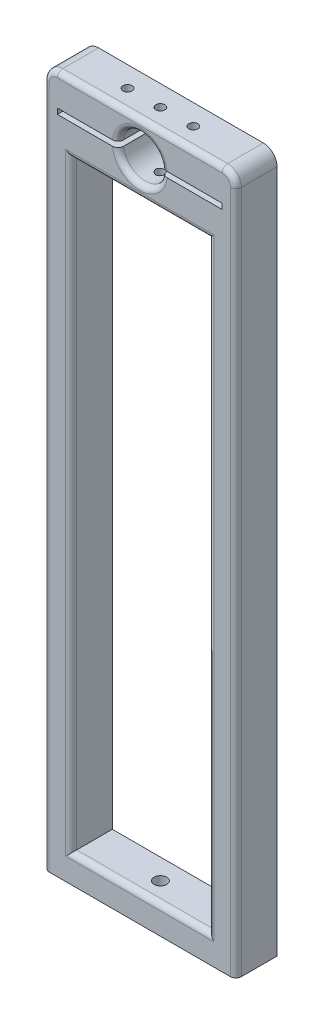
from build123d import *

# Parameters (mm, degrees)
SKETCH_1_W          = 70
SKETCH_1_H          = 15
EXTRUDE_3_DEPTH     = 254
SKETCH_5_W          = 50
SKETCH_5_H          = 219
CUT_EXTRUDE_2_DEPTH = 150
SKETCH_6_R          = 8
CUT_EXTRUDE_3_DEPTH = 150
FILLET_1_R          = 2
FILLET_2_R          = 5
FILLET_3_R          = 5
SKETCH_7_R          = 2.3
CUT_EXTRUDE_4_DEPTH = 150
SKETCH_8_W          = 60
SKETCH_8_H          = 2
CUT_EXTRUDE_5_DEPTH = 257.838470639
FILLET_4_R          = 2
FILLET_7_R          = 2
SKETCH_9_R          = 1.65
CUT_EXTRUDE_6_DEPTH = 30


with BuildPart() as part:
    # 草图1 → 凸台-拉伸3 (new body)
    with BuildSketch(Plane(origin=(0, 0, 0), x_dir=(1, 0, 0), z_dir=(0, 1, 0))):
        Rectangle(SKETCH_1_W, SKETCH_1_H)
    extrude(amount=EXTRUDE_3_DEPTH)

    # 草图5 → 切除-拉伸2 (cut)
    with BuildSketch(Plane.XY.offset(7.5)):
        with Locations((0, 119.5)):
            Rectangle(SKETCH_5_W, SKETCH_5_H)
    extrude(amount=-CUT_EXTRUDE_2_DEPTH, mode=Mode.SUBTRACT)

    # 草图6 → 切除-拉伸3 (cut)
    with BuildSketch(Plane.XY.offset(7.5)):
        with Locations((0, 241.5)):
            Circle(SKETCH_6_R)
    extrude(amount=-CUT_EXTRUDE_3_DEPTH, mode=Mode.SUBTRACT)

    # 圆角1
    fillet_1_edges = [part.edges().sort_by_distance(p)[0] for p in [
        (-8, 241.5, 7.5),
    ]]
    fillet(fillet_1_edges, radius=FILLET_1_R)

    # 圆角2
    fillet_2_edges = [part.edges().sort_by_distance(p)[0] for p in [
        (-35, 254, 0),
    ]]
    fillet(fillet_2_edges, radius=FILLET_2_R)

    # 圆角3
    fillet_3_edges = [part.edges().sort_by_distance(p)[0] for p in [
        (35, 254, 0),
    ]]
    fillet(fillet_3_edges, radius=FILLET_3_R)

    # 草图7 → 切除-拉伸4 (cut)
    with BuildSketch(Plane(origin=(0, 10, 0), x_dir=(1, 0, 0), z_dir=(0, 1, 0))):
        with Locations(Location((0, 0, 0), (0, 0, 270))):
            Circle(SKETCH_7_R)
    extrude(amount=-CUT_EXTRUDE_4_DEPTH, mode=Mode.SUBTRACT)

    # 草图8 → 切除-拉伸5 (cut, through all)
    with BuildSketch(Plane(origin=(0, 0, -7.5), x_dir=(-1, 0, 0), z_dir=(0, 0, -1))):
        with Locations((0, 241.5)):
            Rectangle(SKETCH_8_W, SKETCH_8_H)
    extrude(amount=-CUT_EXTRUDE_5_DEPTH, mode=Mode.SUBTRACT)

    # 圆角4
    fillet_4_edges = [part.edges().sort_by_distance(p)[0] for p in [
        (-35, 124.5, 7.5),
        (0, 254, 7.5),
        (-33.535533906, 252.535533906, 7.5),
        (35, 124.5, 7.5),
        (33.535533906, 252.535533906, 7.5),
    ]]
    fillet(fillet_4_edges, radius=FILLET_4_R)

    # 圆角7
    fillet_7_edges = [part.edges().sort_by_distance(p)[0] for p in [
        (-25, 119.5, 7.5),
        (0, 10, 7.5),
        (25, 119.5, 7.5),
        (0, 229, 7.5),
    ]]
    fillet(fillet_7_edges, radius=FILLET_7_R)

    # 草图9 → 切除-拉伸6 (cut)
    with BuildSketch(Plane(origin=(0, 254, 0), x_dir=(1, 0, 0), z_dir=(0, 1, 0))):
        with Locations(Location((-12, 0, 0), (0, 0, 270))):
            Circle(SKETCH_9_R)
        with Locations(Location((12, 0, 0), (0, 0, 270))):
            Circle(SKETCH_9_R)
        with Locations(Location((0, 0, 0), (0, 0, 270))):
            Circle(SKETCH_9_R)
    extrude(amount=-CUT_EXTRUDE_6_DEPTH, mode=Mode.SUBTRACT)


solid = part.part
